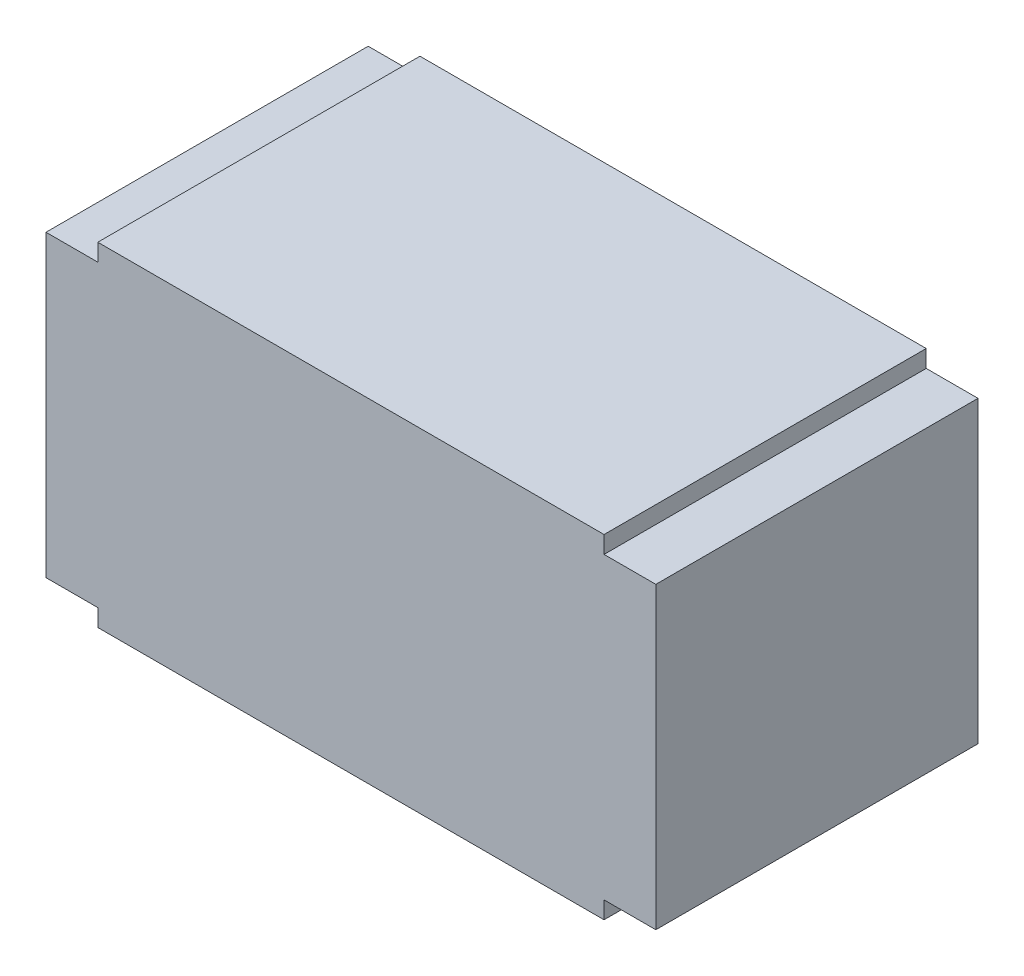
from build123d import *

# Parameters (mm, degrees)
COMPONENT_OUTLINE_DEPTH = 1.4


with BuildPart() as part:
    # 草图1 → Component_Outline (new body)
    with BuildSketch(Plane.XY):
        Polygon((-1.1, -0.725), (-1.1, -0.66), (-1.1, -0.65), (-1.325, -0.65), (-1.325, 0.65), (-1.1, 0.65), (-1.1, 0.725), (1.1, 0.725), (1.1, 0.65), (1.325, 0.65), (1.325, -0.65), (1.1, -0.65), (1.1, -0.725), align=None)
    extrude(amount=COMPONENT_OUTLINE_DEPTH)


solid = part.part
